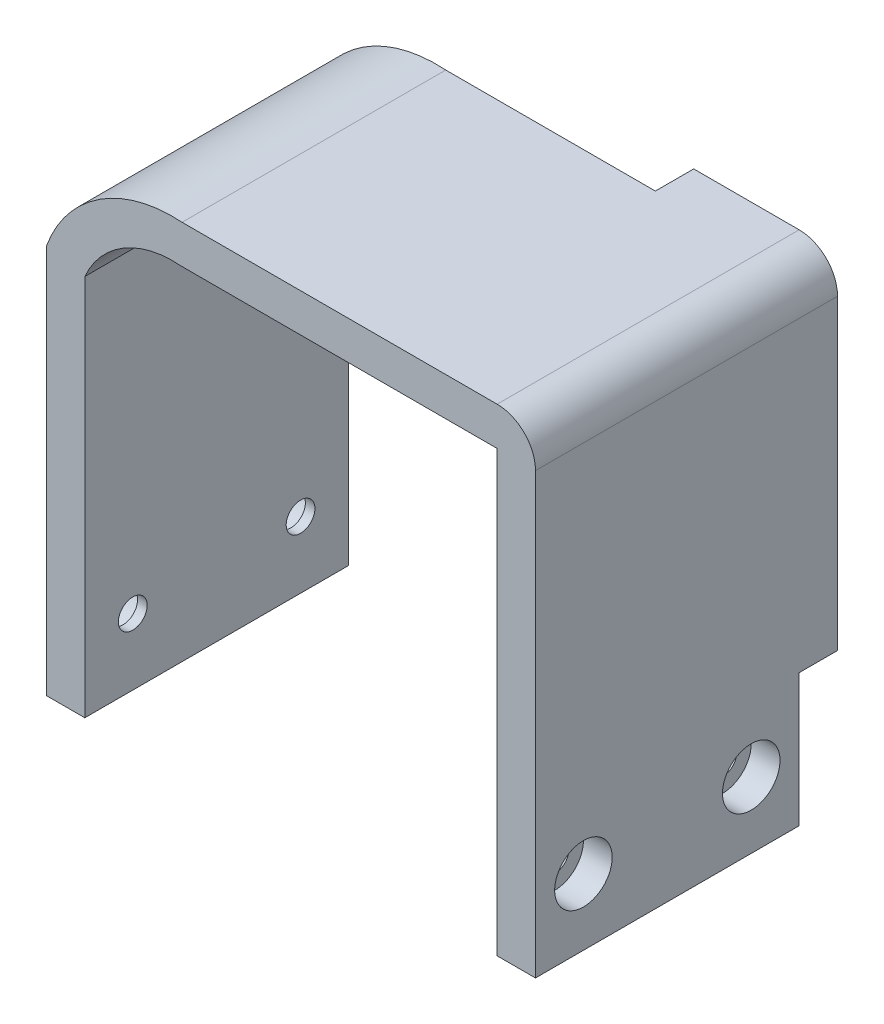
from build123d import *

# Parameters (mm, degrees)
BOSS_EXTRUDE1_DEPTH = 27.5
SKETCH3_W           = 15
SKETCH3_H           = 36
BOSS_EXTRUDE2_DEPTH = 4
SKETCH4_R           = 1.25
CUT_EXTRUDE1_DEPTH  = 65.32721152
CUT_EXTRUDE2_START  = -2
SKETCH4_3_R         = 2
SKETCH4_3_R_2       = 1.25
CUT_EXTRUDE2_DEPTH  = 2
SKETCH5_R           = 1.5
CUT_EXTRUDE3_DEPTH  = 76.905069848
SKETCH5_3_R         = 3
SKETCH5_3_R_2       = 1.5
CUT_EXTRUDE4_DEPTH  = 3
FILLET1_R           = 4


with BuildPart() as part:
    # Sketch1 → Boss-Extrude1 (new body)
    with BuildSketch(Plane.XY):
        with BuildLine():
            Line((-27.263565268, -0.826290167), (-27.263565268, 39.032085652))
            ThreePointArc((-27.263565268, 39.032085652), (-23.226265639, 43.618644017), (-17.274109595, 45))
            Line((-17.274109595, 45), (15.736434732, 45))
            Line((15.736434732, 45), (15.736434732, -0.826290167))
            Line((15.736434732, -0.826290167), (19.736434732, -0.826290167))
            Line((19.736434732, -0.826290167), (19.736434732, 49))
            Line((19.736434732, 49), (-17.122997301, 49))
            ThreePointArc((-17.122997301, 49), (-25.736007979, 46.766595309), (-31.263565268, 39.793922947))
            Line((-31.263565268, 39.793922947), (-31.263565268, -0.826290167))
            Line((-31.263565268, -0.826290167), (-27.263565268, -0.826290167))
        make_face()
    extrude(amount=BOSS_EXTRUDE1_DEPTH)

    # Sketch3 → Boss-Extrude2 (add)
    with BuildSketch(Plane(origin=(0, 0, 0), x_dir=(-1, 0, 0), z_dir=(0, 0, -1))):
        with Locations((-12.236434732, 31)):
            Rectangle(SKETCH3_W, SKETCH3_H)
    extrude(amount=BOSS_EXTRUDE2_DEPTH)

    # Sketch4 → Cut-Extrude1 (cut, through all)
    with BuildSketch(Plane.XY):
        with Locations((12.736434732, 42.5)):
            Circle(SKETCH4_R)
        with Locations((12.736434732, 15.5)):
            Circle(SKETCH4_R)
    extrude(amount=-CUT_EXTRUDE1_DEPTH, mode=Mode.SUBTRACT)

    # Sketch4<3> → Cut-Extrude2 (cut)
    # profile 1 of 2: a face of its own
    with BuildSketch(Plane.XY.offset(CUT_EXTRUDE2_START)):
        with Locations(Location((12.736434732, 42.5, 0), (0, 0, 180))):
            Circle(SKETCH4_3_R)
        with Locations((12.736434732, 42.5)):
            Circle(SKETCH4_3_R_2, mode=Mode.SUBTRACT)
    # profile 2 of 2: a face of its own
    with BuildSketch(Plane.XY.offset(CUT_EXTRUDE2_START)):
        with Locations(Location((12.736434732, 15.5, 0), (0, 0, 180))):
            Circle(SKETCH4_3_R)
        with Locations((12.736434732, 15.5)):
            Circle(SKETCH4_3_R_2, mode=Mode.SUBTRACT)
    extrude(amount=-CUT_EXTRUDE2_DEPTH, mode=Mode.SUBTRACT)

    # Sketch5 → Cut-Extrude3 (cut, through all)
    with BuildSketch(Plane(origin=(19.736434732, 0, 0), x_dir=(0, 0, -1), z_dir=(1, 0, 0))):
        with Locations((-22.5, 6.086854916)):
            Circle(SKETCH5_R)
        with Locations((-5, 6.086854916)):
            Circle(SKETCH5_R)
    extrude(amount=-CUT_EXTRUDE3_DEPTH, mode=Mode.SUBTRACT)

    # Sketch5<3> → Cut-Extrude4 (cut)
    # profile 1 of 2: a face of its own
    with BuildSketch(Plane(origin=(19.736434732, 0, 0), x_dir=(0, 0, -1), z_dir=(1, 0, 0))):
        with Locations((-22.5, 6.086854916)):
            Circle(SKETCH5_3_R)
        with Locations((-22.5, 6.086854916)):
            Circle(SKETCH5_3_R_2, mode=Mode.SUBTRACT)
    # profile 2 of 2: a face of its own
    with BuildSketch(Plane(origin=(19.736434732, 0, 0), x_dir=(0, 0, -1), z_dir=(1, 0, 0))):
        with Locations((-5, 6.086854916)):
            Circle(SKETCH5_3_R)
        with Locations((-5, 6.086854916)):
            Circle(SKETCH5_3_R_2, mode=Mode.SUBTRACT)
    cut_extrude4 = extrude(amount=-CUT_EXTRUDE4_DEPTH, mode=Mode.SUBTRACT)

    # Mirror1: Cut-Extrude4 across plane
    add(cut_extrude4.mirror(Plane(origin=(-5.763565268, 0, 0), x_dir=(0, 0, 1), z_dir=(1, 0, 0))), mode=Mode.SUBTRACT)

    # Fillet1
    fillet1_edges = [part.edges().sort_by_distance(p)[0] for p in [
        (19.736434732, 49, 11.75),
    ]]
    fillet(fillet1_edges, radius=FILLET1_R)


solid = part.part
